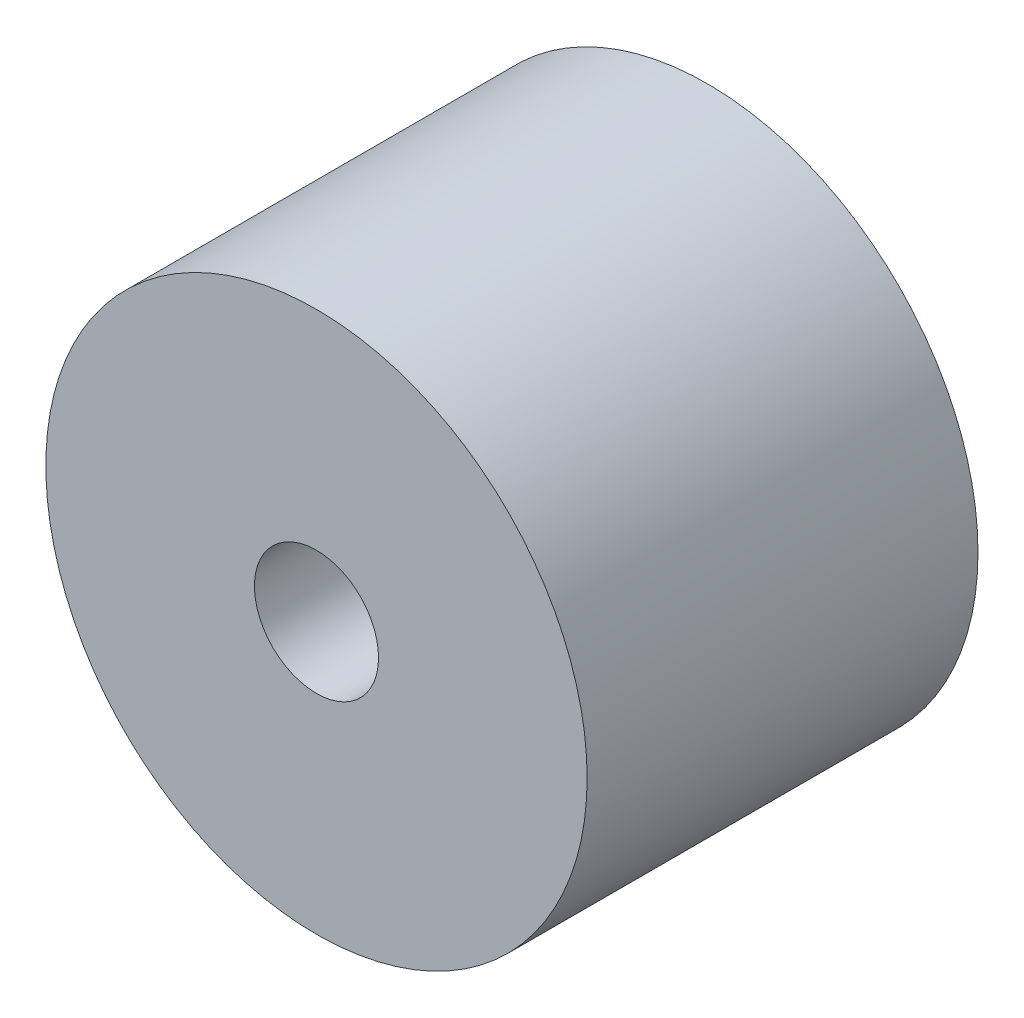
from build123d import *

# Parameters (mm, degrees)
SKETCH1_R           = 27.7
BOSS_EXTRUDE1_DEPTH = 40
SKETCH2_R           = 6.35
CUT_EXTRUDE1_DEPTH  = 40


with BuildPart() as part:
    # Sketch1 → Boss-Extrude1 (new body)
    with BuildSketch(Plane.XY):
        Circle(SKETCH1_R)
    extrude(amount=BOSS_EXTRUDE1_DEPTH)

    # Sketch2 → Cut-Extrude1 (cut)
    with BuildSketch(Plane.XY.offset(40)):
        Circle(SKETCH2_R)
    extrude(amount=-CUT_EXTRUDE1_DEPTH, mode=Mode.SUBTRACT)


solid = part.part
